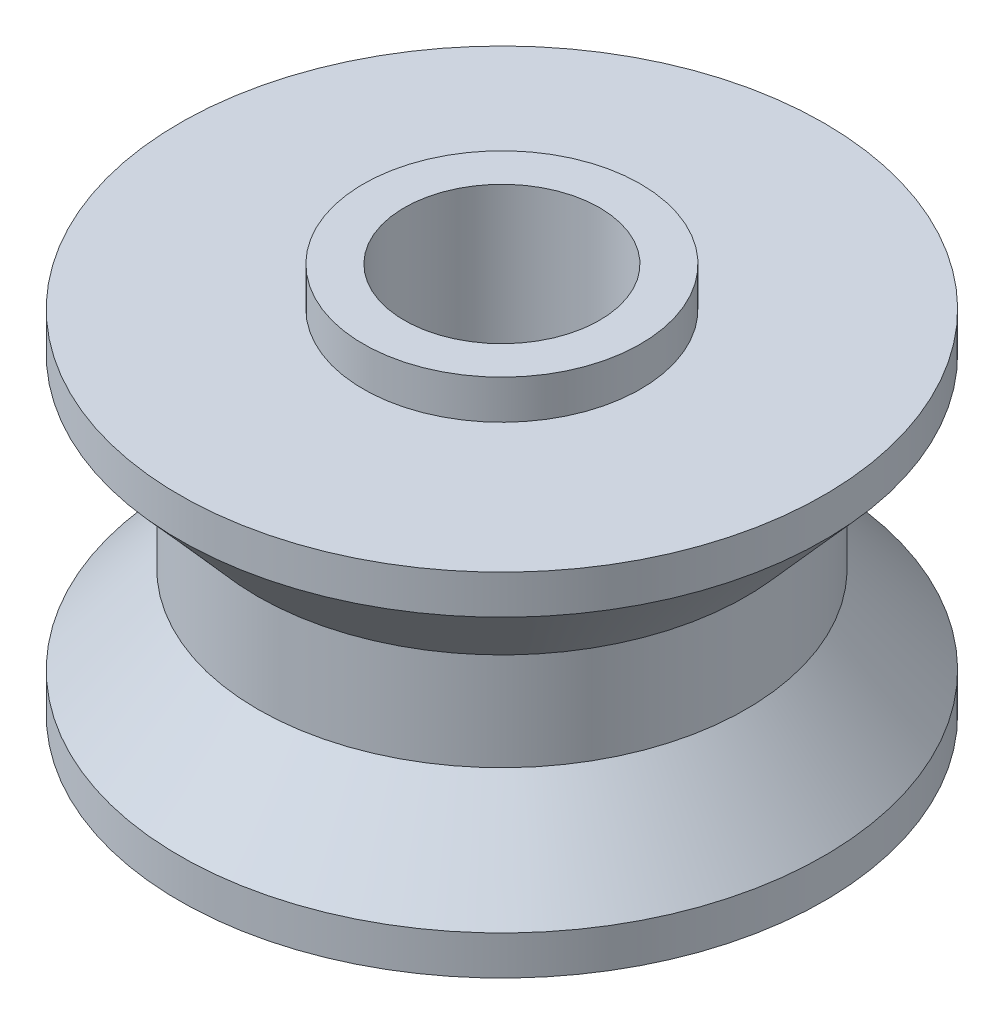
from build123d import *


with BuildPart() as part:
    # 草图1 → 旋转1 (revolve)
    with BuildSketch(Plane.XY, mode=Mode.PRIVATE) as revolve_1_sk:
        Polygon((2.5, 5.5), (3.55, 5.5), (3.55, 4.5), (8.25, 4.5), (8.25, 3.5), (6.25, 1.25), (6.25, -1.25), (8.25, -3.5), (8.25, -4.5), (3.55, -4.5), (3.55, -5.5), (2.5, -5.5), align=None)
    revolve(revolve_1_sk.sketch.rotate(Axis((0, 0, 0), (0, 1, 0)), 90), axis=Axis((0, 0, 0), (0, 1, 0)))


solid = part.part
